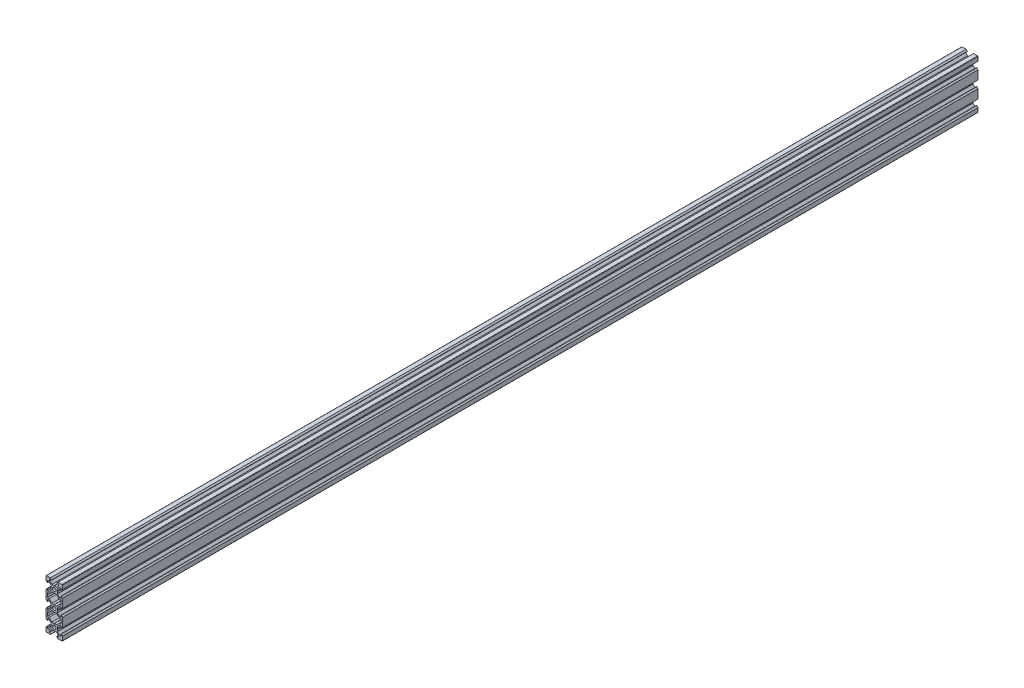
from build123d import *

# Parameters (mm, degrees)
BOSS_EXTRU_1_DEPTH = 1120


with BuildPart() as part:
    # Esquisse1 → Boss.-Extru.1 (new body)
    with BuildSketch(Plane.XY):
        with BuildLine():
            Line((-9.5, 10), (-4.58, 10))
            Line((-4.58, 10), (-3.125, 8.545))
            Line((-3.125, 8.545), (-3.125, 8.2))
            Line((-3.125, 8.2), (-5.5, 8.2))
            Line((-5.5, 8.2), (-5.5, 6.560660172))
            Line((-5.5, 6.560660172), (-2.839339828, 3.9))
            Line((-2.839339828, 3.9), (-0.21, 3.9))
            Line((-0.21, 3.9), (0, 3.69))
            Line((0, 3.69), (0, 2.1))
            ThreePointArc((0, 2.1), (-2.1, 0), (0, -2.1))
            Line((0, -2.1), (0, -3.69))
            Line((0, -3.69), (-0.21, -3.9))
            Line((-0.21, -3.9), (-2.839339828, -3.9))
            Line((-2.839339828, -3.9), (-6.239339828, -7.3))
            Line((-6.239339828, -7.3), (-8.2, -7.3))
            Line((-8.2, -7.3), (-8.2, -12.7))
            Line((-8.2, -12.7), (-6.239339828, -12.7))
            Line((-6.239339828, -12.7), (-2.839339828, -16.1))
            Line((-2.839339828, -16.1), (-0.21, -16.1))
            Line((-0.21, -16.1), (0, -16.31))
            Line((0, -16.31), (0, -17.9))
            ThreePointArc((0, -17.9), (-2.1, -20), (0, -22.1))
            Line((0, -22.1), (0, -23.69))
            Line((0, -23.69), (-0.21, -23.9))
            Line((-0.21, -23.9), (-2.839339828, -23.9))
            Line((-2.839339828, -23.9), (-6.239339828, -27.3))
            Line((-6.239339828, -27.3), (-8.2, -27.3))
            Line((-8.2, -27.3), (-8.2, -32.7))
            Line((-8.2, -32.7), (-6.239339828, -32.7))
            Line((-6.239339828, -32.7), (-2.839339828, -36.1))
            Line((-2.839339828, -36.1), (-0.21, -36.1))
            Line((-0.21, -36.1), (0, -36.31))
            Line((0, -36.31), (0, -37.9))
            ThreePointArc((0, -37.9), (-2.1, -40), (0, -42.1))
            Line((0, -42.1), (0, -43.69))
            Line((0, -43.69), (-0.21, -43.9))
            Line((-0.21, -43.9), (-2.839339828, -43.9))
            Line((-2.839339828, -43.9), (-5.5, -46.560660172))
            Line((-5.5, -46.560660172), (-5.5, -48.2))
            Line((-5.5, -48.2), (-3.125, -48.2))
            Line((-3.125, -48.2), (-3.125, -48.545))
            Line((-3.125, -48.545), (-4.58, -50))
            Line((-4.58, -50), (-9.5, -50))
            ThreePointArc((-9.5, -50), (-9.853553391, -49.853553391), (-10, -49.5))
            Line((-10, -49.5), (-10, -44.58))
            Line((-10, -44.58), (-8.545, -43.125))
            Line((-8.545, -43.125), (-8.2, -43.125))
            Line((-8.2, -43.125), (-8.2, -45.5))
            Line((-8.2, -45.5), (-6.560660172, -45.5))
            Line((-6.560660172, -45.5), (-3.9, -42.839339828))
            Line((-3.9, -42.839339828), (-3.9, -40.21))
            Line((-3.9, -40.21), (-3.69, -40))
            Line((-3.69, -40), (-3.9, -39.79))
            Line((-3.9, -39.79), (-3.9, -37.160660172))
            Line((-3.9, -37.160660172), (-6.560660172, -34.5))
            Line((-6.560660172, -34.5), (-8.2, -34.5))
            Line((-8.2, -34.5), (-8.2, -36.875))
            Line((-8.2, -36.875), (-8.545, -36.875))
            Line((-8.545, -36.875), (-10, -35.42))
            Line((-10, -35.42), (-10, -24.58))
            Line((-10, -24.58), (-8.545, -23.125))
            Line((-8.545, -23.125), (-8.2, -23.125))
            Line((-8.2, -23.125), (-8.2, -25.5))
            Line((-8.2, -25.5), (-6.560660172, -25.5))
            Line((-6.560660172, -25.5), (-3.9, -22.839339828))
            Line((-3.9, -22.839339828), (-3.9, -20.21))
            Line((-3.9, -20.21), (-3.69, -20))
            Line((-3.69, -20), (-3.9, -19.79))
            Line((-3.9, -19.79), (-3.9, -17.160660172))
            Line((-3.9, -17.160660172), (-6.560660172, -14.5))
            Line((-6.560660172, -14.5), (-8.2, -14.5))
            Line((-8.2, -14.5), (-8.2, -16.875))
            Line((-8.2, -16.875), (-8.545, -16.875))
            Line((-8.545, -16.875), (-10, -15.42))
            Line((-10, -15.42), (-10, -4.58))
            Line((-10, -4.58), (-8.545, -3.125))
            Line((-8.545, -3.125), (-8.2, -3.125))
            Line((-8.2, -3.125), (-8.2, -5.5))
            Line((-8.2, -5.5), (-6.560660172, -5.5))
            Line((-6.560660172, -5.5), (-3.9, -2.839339828))
            Line((-3.9, -2.839339828), (-3.9, -0.21))
            Line((-3.9, -0.21), (-3.69, 0))
            Line((-3.69, 0), (-3.9, 0.21))
            Line((-3.9, 0.21), (-3.9, 2.839339828))
            Line((-3.9, 2.839339828), (-6.560660172, 5.5))
            Line((-6.560660172, 5.5), (-8.2, 5.5))
            Line((-8.2, 5.5), (-8.2, 3.125))
            Line((-8.2, 3.125), (-8.545, 3.125))
            Line((-8.545, 3.125), (-10, 4.58))
            Line((-10, 4.58), (-10, 9.5))
            ThreePointArc((-10, 9.5), (-9.853553391, 9.853553391), (-9.5, 10))
        make_face()
    boss_extru_1 = extrude(amount=BOSS_EXTRU_1_DEPTH)

    # Symétrie1: Boss.-Extru.1 across plane
    add(boss_extru_1.mirror(Plane(origin=(0, 3.69, 1120), x_dir=(0, 0, 1), z_dir=(-1, 0, 0))))


solid = part.part
